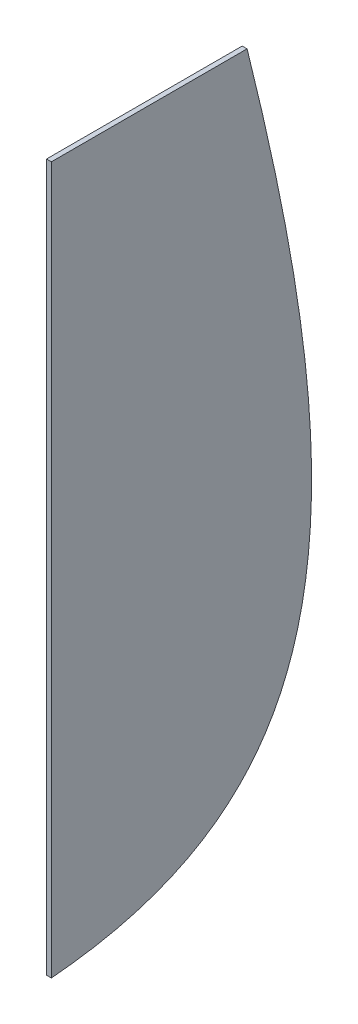
from build123d import *

# Parameters (mm, degrees)
EXTRUDE_1_DEPTH   = 0.5
MOVE_BODY_1_ANGLE = 180
MOVE_BODY_2_ANGLE = 90
MOVE_BODY_3_ANGLE = 90
MOVE_BODY_4_ANGLE = 180


with BuildPart() as part:
    # 草图1 → 凸台-拉伸1 (new, symmetric)
    with BuildSketch(Plane.XY):
        with BuildLine():
            Line((15, 0), (145, 0))
            add(Edge.make_bspline(
                [(0, -40.143966229), (96.105563962, -64.070119442), (140.053769682, -58.282483629), (145, 0)],
                knots=[0, 0, 0, 0, 1, 1, 1, 1], degree=3))
            Line((0, -40.143966229), (0, 0))
            Line((0, 0), (15, 0))
        make_face()
    extrude(amount=EXTRUDE_1_DEPTH, both=True)


with BuildPart() as part_1:
    # Move Body 1: moved
    add(part.part.rotate(Axis((0, 0, 0), (0, 1, 0)), MOVE_BODY_1_ANGLE))


with BuildPart() as part_2:
    # Move Body 2: moved
    add(part_1.part.rotate(Axis((0, 0, 0), (0, 0, -1)), MOVE_BODY_2_ANGLE))


with BuildPart() as part_3:
    # Move Body 3: moved
    add(part_2.part.rotate(Axis((0, 0, 0), (0, -1, 0)), MOVE_BODY_3_ANGLE))


with BuildPart() as part_4:
    # Move Body 4: moved
    add(part_3.part.rotate(Axis((0, 0, 0), (0, 0, 1)), MOVE_BODY_4_ANGLE))


solid = part_4.part
